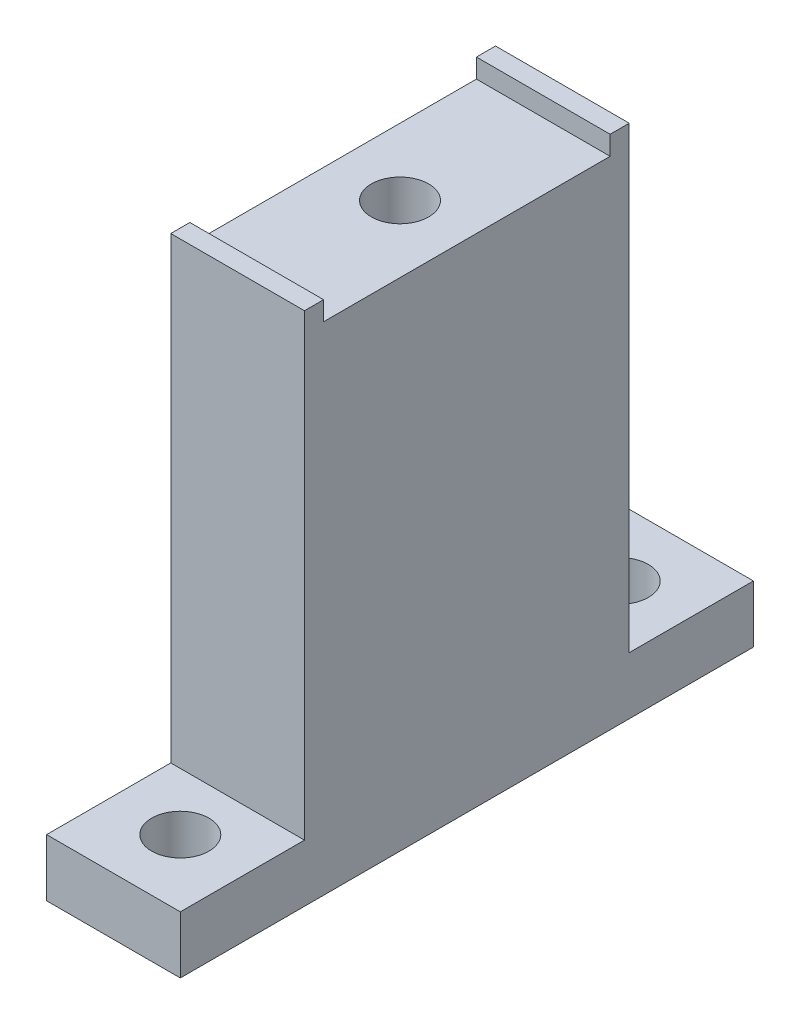
from build123d import *

# Parameters (mm, degrees)
SKETCH1_W           = 7
SKETCH1_H           = 30
BOSS_EXTRUDE1_DEPTH = 3
SKETCH2_R           = 1.5
CUT_EXTRUDE1_DEPTH  = 3
SKETCH3_W           = 7
SKETCH3_H           = 8.5
BOSS_EXTRUDE2_DEPTH = 23
SKETCH4_R           = 1.5
CUT_EXTRUDE3_DEPTH  = 12
SKETCH5_W           = 7
SKETCH5_H           = 1
BOSS_EXTRUDE3_DEPTH = 1


with BuildPart() as part:
    # Sketch1 → Boss-Extrude1 (new body)
    with BuildSketch(Plane(origin=(0, 0, 0), x_dir=(1, 0, 0), z_dir=(0, 1, 0))):
        with Locations((-3.5, 15)):
            Rectangle(SKETCH1_W, SKETCH1_H)
    extrude(amount=BOSS_EXTRUDE1_DEPTH)

    # Sketch2 → Cut-Extrude1 (cut)
    with BuildSketch(Plane(origin=(0, 3, 0), x_dir=(1, 0, 0), z_dir=(0, 1, 0))):
        with Locations(Location((-3.5, 26.5, 0), (0, 0, 270))):
            Circle(SKETCH2_R)
        with Locations(Location((-3.5, 3.5, 0), (0, 0, 270))):
            Circle(SKETCH2_R)
    extrude(amount=-CUT_EXTRUDE1_DEPTH, mode=Mode.SUBTRACT)

    # Sketch3 → Boss-Extrude2 (add)
    with BuildSketch(Plane(origin=(0, 3, 0), x_dir=(1, 0, 0), z_dir=(0, 1, 0))):
        with Locations((-3.5, 19.25)):
            Rectangle(SKETCH3_W, SKETCH3_H)
        with Locations((-3.5, 10.75)):
            Rectangle(SKETCH3_W, SKETCH3_H)
    extrude(amount=BOSS_EXTRUDE2_DEPTH)

    # Sketch4 → Cut-Extrude3 (cut)
    with BuildSketch(Plane(origin=(0, 26, 0), x_dir=(1, 0, 0), z_dir=(0, 1, 0))):
        with Locations(Location((-3.5, 15, 0), (0, 0, 270))):
            Circle(SKETCH4_R)
    extrude(amount=-CUT_EXTRUDE3_DEPTH, mode=Mode.SUBTRACT)

    # Sketch5 → Boss-Extrude3 (add)
    with BuildSketch(Plane(origin=(0, 26, 0), x_dir=(1, 0, 0), z_dir=(0, 1, 0))):
        with Locations((-3.5, 23)):
            Rectangle(SKETCH5_W, SKETCH5_H)
        with Locations((-3.5, 7)):
            Rectangle(SKETCH5_W, SKETCH5_H)
    extrude(amount=BOSS_EXTRUDE3_DEPTH)


solid = part.part
